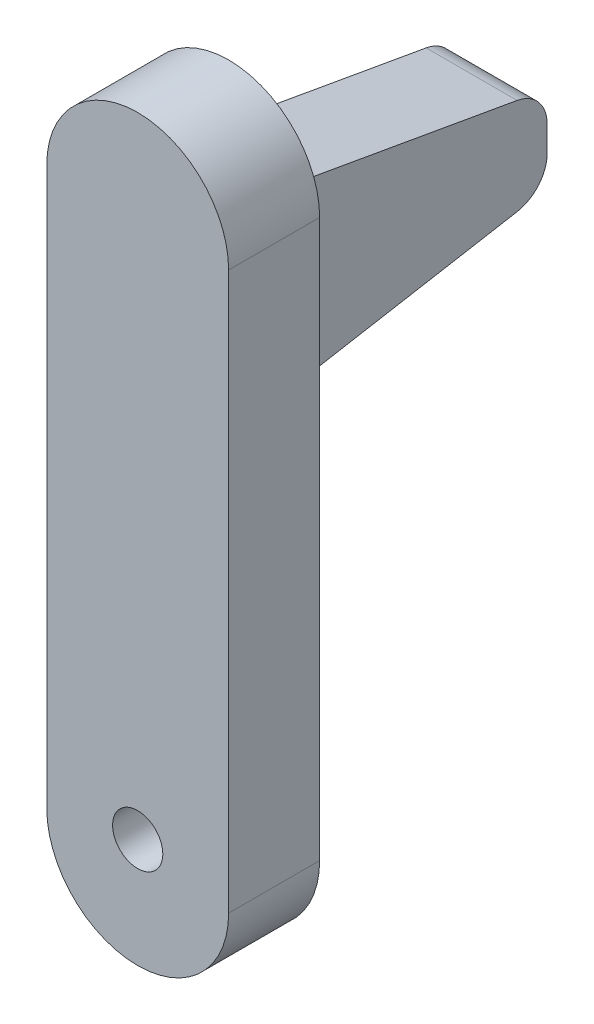
from build123d import *

# Parameters (mm, degrees)
SKETCH1_R                = 1.7526
BOSS_EXTRUDE1_DEPTH      = 6.35
BOSS_EXTRUDE2_DEPTH      = 3.175
BOSS_EXTRUDE2_DEPTH_BACK = 3.175


with BuildPart() as part:
    # Sketch1 → Boss-Extrude1 (new body)
    with BuildSketch(Plane.XY):
        with BuildLine():
            Line((-6.345006919, -1.27), (-6.345006919, 37.592))
            ThreePointArc((-6.345006919, 37.592), (0, 43.937006919), (6.345006919, 37.592))
            Line((6.345006919, 37.592), (6.345006919, -1.27))
            ThreePointArc((6.345006919, -1.27), (0, -7.615006919), (-6.345006919, -1.27))
        make_face()
        Circle(SKETCH1_R, mode=Mode.SUBTRACT)
    extrude(amount=BOSS_EXTRUDE1_DEPTH)

    # Sketch2 → Boss-Extrude2 (add, two sides: drawn at the far end of the back side and taken through both)
    with BuildSketch(Plane(origin=(0, 0, 0), x_dir=(0, 0, -1), z_dir=(1, 0, 0)).offset(-BOSS_EXTRUDE2_DEPTH_BACK)):
        with BuildLine():
            Line((0, 37.592), (0, 24.892))
            Line((0, 24.892), (16.951066371, 27.880930353))
            ThreePointArc((16.951066371, 27.880930353), (18.455752886, 28.749661517), (19.05, 30.382342046))
            Line((19.05, 30.382342046), (19.05, 32.101657954))
            ThreePointArc((19.05, 32.101657954), (18.455752886, 33.734338483), (16.951066371, 34.603069647))
            Line((16.951066371, 34.603069647), (0, 37.592))
        make_face()
    extrude(amount=BOSS_EXTRUDE2_DEPTH + BOSS_EXTRUDE2_DEPTH_BACK)


solid = part.part
